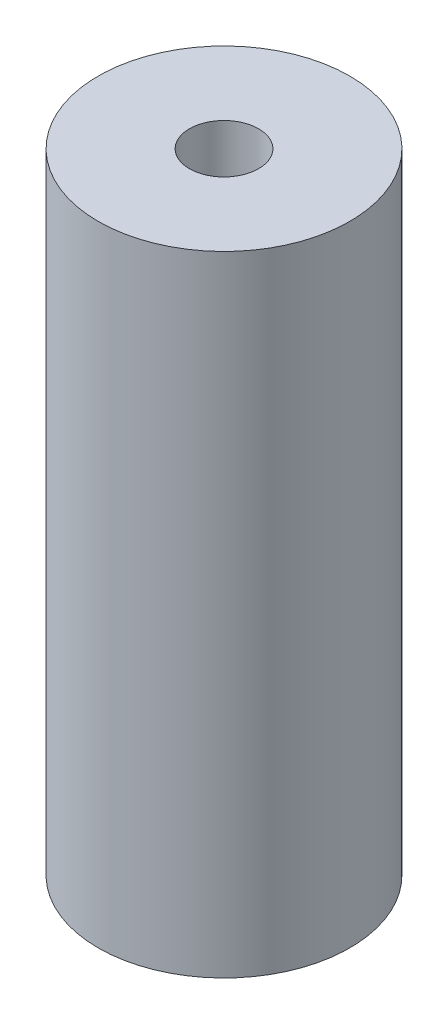
from build123d import *

# Parameters (mm, degrees)
SKETCH_1_R                   = 6
EXTRUDE_1_DEPTH              = 30
HOLE_WIZARD_M4_1_D           = 3.3
HOLE_WIZARD_M4_1_CSINK_D     = 4.05
HOLE_WIZARD_M4_1_CSINK_ANGLE = 90


with BuildPart() as part:
    # 草图1 → 凸台-拉伸1 (new body)
    with BuildSketch(Plane(origin=(0, 0, 0), x_dir=(1, 0, 0), z_dir=(0, 1, 0))):
        with Locations(Location((0, 0, 0), (0, 0, 270))):
            Circle(SKETCH_1_R)
    extrude(amount=EXTRUDE_1_DEPTH)

    # M4 螺纹孔1 (through all)
    with Locations(Plane(origin=(0, 0, 0), x_dir=(-1, 0, 0), z_dir=(0, -1, 0))):
        with Locations((0, 0)):
            CounterSinkHole(HOLE_WIZARD_M4_1_D / 2, HOLE_WIZARD_M4_1_CSINK_D / 2, counter_sink_angle=HOLE_WIZARD_M4_1_CSINK_ANGLE)


solid = part.part
